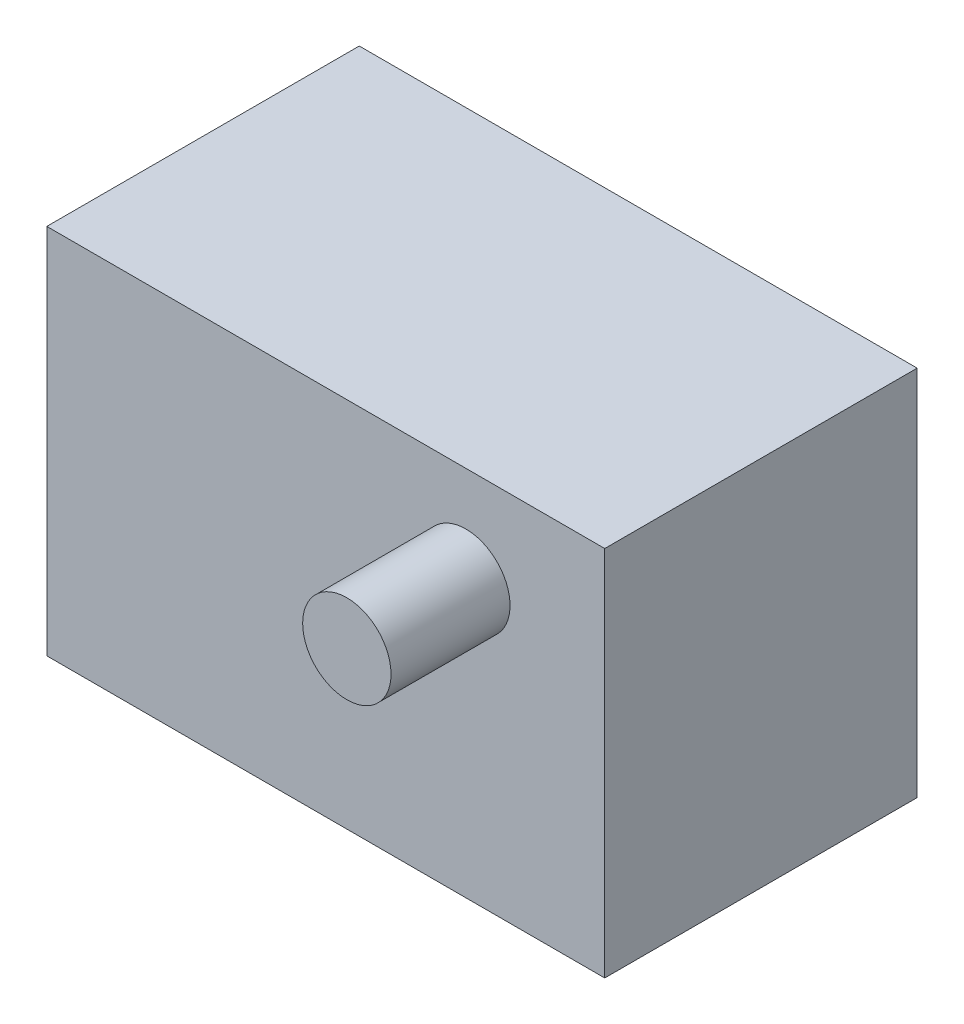
from build123d import *

# Parameters (mm, degrees)
CROQUIS1_W              = 75
CROQUIS1_H              = 50
SALIENTE_EXTRUIR1_DEPTH = 42
CROQUIS2_R              = 5.939733441
SALIENTE_EXTRUIR2_DEPTH = 16


with BuildPart() as part:
    # Croquis1 → Saliente-Extruir1 (new body)
    with BuildSketch(Plane.XY):
        Rectangle(CROQUIS1_W, CROQUIS1_H)
    extrude(amount=-SALIENTE_EXTRUIR1_DEPTH)

    # Croquis2 → Saliente-Extruir2 (add)
    with BuildSketch(Plane.XY):
        with Locations(Location((18.830639627, 12, 0), (0, 0, 180))):
            Circle(CROQUIS2_R)
    extrude(amount=SALIENTE_EXTRUIR2_DEPTH)


solid = part.part
